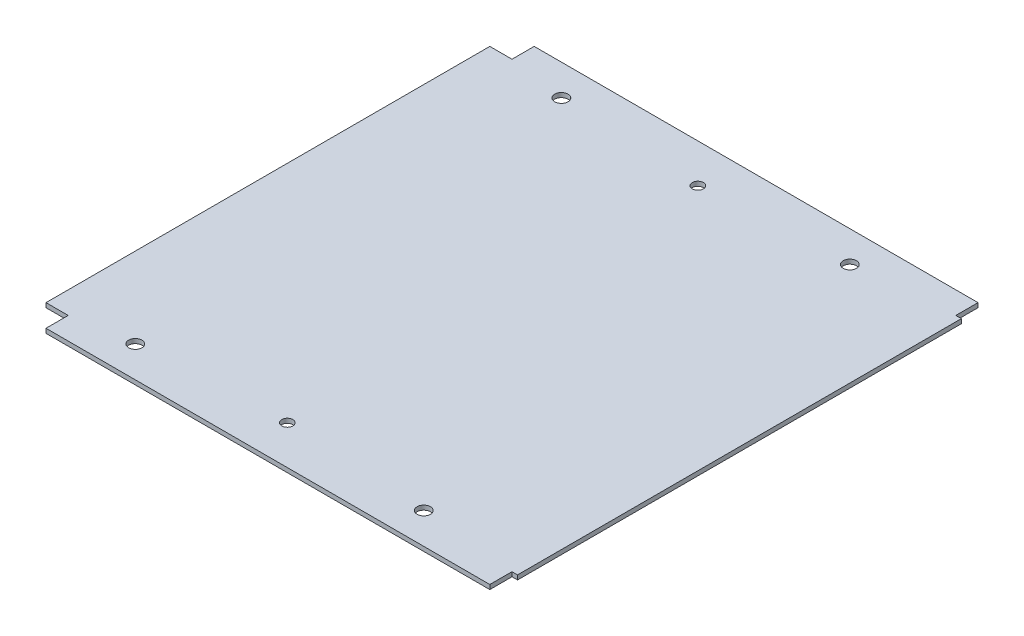
from build123d import *

# Parameters (mm, degrees)
SKETCH1_W           = 440
SKETCH1_H           = 440
BOSS_EXTRUDE1_DEPTH = 4
SKETCH3_W           = 20
SKETCH3_H           = 20
CUT_EXTRUDE1_DEPTH  = 10
SKETCH4_R           = 6
SKETCH4_R_2         = 5
CUT_EXTRUDE2_DEPTH  = 10
SKETCH5_W           = 15
SKETCH5_H           = 400
CUT_EXTRUDE3_DEPTH  = 312.152695634


with BuildPart() as part:
    # Sketch1 → Boss-Extrude1 (new body)
    with BuildSketch(Plane(origin=(0, 0, 0), x_dir=(1, 0, 0), z_dir=(0, 1, 0))):
        Rectangle(SKETCH1_W, SKETCH1_H)
    extrude(amount=BOSS_EXTRUDE1_DEPTH)

    # Sketch3 → Cut-Extrude1 (cut)
    with BuildSketch(Plane(origin=(0, 4, 0), x_dir=(1, 0, 0), z_dir=(0, 1, 0))):
        with Locations((-210, -210)):
            Rectangle(SKETCH3_W, SKETCH3_H)
        with Locations((210, -210)):
            Rectangle(SKETCH3_W, SKETCH3_H)
        with Locations((210, 210)):
            Rectangle(SKETCH3_W, SKETCH3_H)
        with Locations((-210, 210)):
            Rectangle(SKETCH3_W, SKETCH3_H)
    extrude(amount=-CUT_EXTRUDE1_DEPTH, mode=Mode.SUBTRACT)

    # Sketch4 → Cut-Extrude2 (cut)
    with BuildSketch(Plane(origin=(0, 4, 0), x_dir=(1, 0, 0), z_dir=(0, 1, 0))):
        with Locations(Location((-147.5, 192, 0), (0, 0, 270))):
            Circle(SKETCH4_R)
        with Locations(Location((112.5, 192, 0), (0, 0, 270))):
            Circle(SKETCH4_R)
        with Locations(Location((-17.5, 185, 0), (0, 0, 270))):
            Circle(SKETCH4_R_2)
        with Locations(Location((112.5, -192, 0), (0, 0, 270))):
            Circle(SKETCH4_R)
        with Locations(Location((-17.5, -185, 0), (0, 0, 270))):
            Circle(SKETCH4_R_2)
        with Locations(Location((-147.5, -192, 0), (0, 0, 270))):
            Circle(SKETCH4_R)
    extrude(amount=-CUT_EXTRUDE2_DEPTH, mode=Mode.SUBTRACT)

    # Sketch5 → Cut-Extrude3 (cut, through all)
    with BuildSketch(Plane(origin=(0, 4, 0), x_dir=(1, 0, 0), z_dir=(0, 1, 0))):
        with Locations((212.5, 0)):
            Rectangle(SKETCH5_W, SKETCH5_H)
    extrude(amount=-CUT_EXTRUDE3_DEPTH, mode=Mode.SUBTRACT)


solid = part.part
